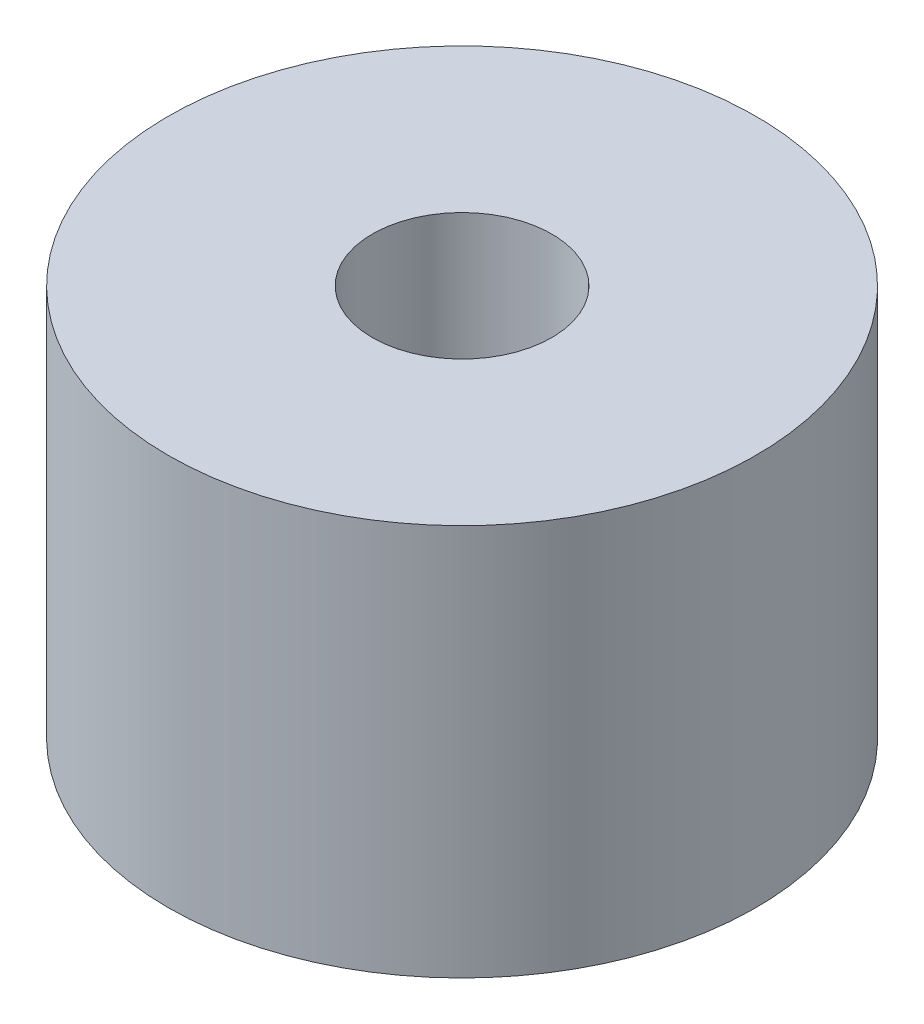
from build123d import *

# Parameters (mm, degrees)
SKETCH1_R           = 18
SKETCH1_R_2         = 5.5
BOSS_EXTRUDE1_DEPTH = 24


with BuildPart() as part:
    # Sketch1 → Boss-Extrude1 (new body)
    with BuildSketch(Plane(origin=(0, 0, 0), x_dir=(1, 0, 0), z_dir=(0, 1, 0))):
        with Locations(Location((0, 0, 0), (0, 0, 270))):
            Circle(SKETCH1_R)
        with Locations(Location((0, 0, 0), (0, 0, 270))):
            Circle(SKETCH1_R_2, mode=Mode.SUBTRACT)
    extrude(amount=BOSS_EXTRUDE1_DEPTH)


solid = part.part
